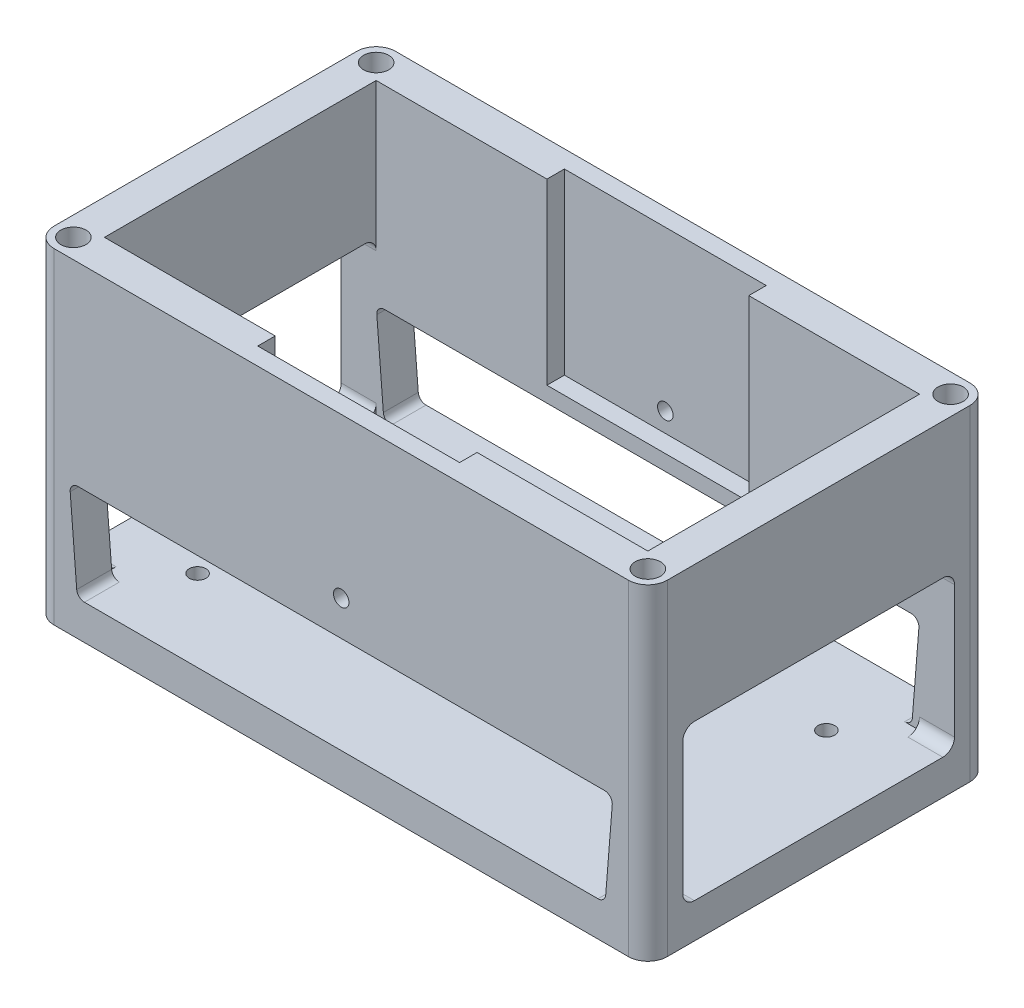
from build123d import *

# Parameters (mm, degrees)
BASE_W               = 79
BASE_H               = 44
BASE_R               = 1.075
BOSS_EXTRUDE1_DEPTH  = 42
SHELL1_T             = -4.5
CUT_EXTRUDE2_START   = 4.5
BASE_7_R             = 1.075
CUT_EXTRUDE2_DEPTH   = 67.211020086
CUT_EXTRUDE3_START   = 2
BASE_8_R             = 1.075
CUT_EXTRUDE3_DEPTH   = 2
SKETCH3_W            = 26
SKETCH3_H            = 39.5
CUT_EXTRUDE4_DEPTH   = 23
FILLET1_R            = 2.5
CUT_EXTRUDE5_DEPTH   = 39.5
CUT_EXTRUDE6_DEPTH   = 74.5
FILLET2_R            = 1
MOUNT_R              = 1.625
CUT_EXTRUDE7_DEPTH   = 2.4
CUT_EXTRUDE8_START   = -2.25
CAMERA_MOUNT_HOLE_R  = 1
CUT_EXTRUDE8_DEPTH   = 75.777581073
FILLET2_OF_MIRROR3_R = 1


with BuildPart() as part:
    # Base → Boss-Extrude1 (new body)
    # profile 1 of 9: a face of its own
    with BuildSketch(Plane(origin=(0, 0, 0), x_dir=(1, 0, 0), z_dir=(0, 1, 0))):
        Rectangle(BASE_W, BASE_H)
        Polygon((27, -10.345299462), (27, -12.654700538), (29, -13.809401077), (31, -12.654700538), (31, -10.345299462), (29, -9.190598923), align=None, mode=Mode.SUBTRACT)
        Polygon((-31, -10.345299462), (-31, -12.654700538), (-29, -13.809401077), (-27, -12.654700538), (-27, -10.345299462), (-29, -9.190598923), align=None, mode=Mode.SUBTRACT)
        Polygon((-31, 12.654700538), (-31, 10.345299462), (-29, 9.190598923), (-27, 10.345299462), (-27, 12.654700538), (-29, 13.809401077), align=None, mode=Mode.SUBTRACT)
        Polygon((27, 12.654700538), (27, 10.345299462), (29, 9.190598923), (31, 10.345299462), (31, 12.654700538), (29, 13.809401077), align=None, mode=Mode.SUBTRACT)
    # profile 2 of 9: a face of its own
    with BuildSketch(Plane(origin=(0, 0, 0), x_dir=(1, 0, 0), z_dir=(0, 1, 0))):
        Polygon((-29, -9.190598923), (-31, -10.345299462), (-31, -12.654700538), (-29, -13.809401077), (-27, -12.654700538), (-27, -10.345299462), align=None)
        with Locations((-29, -11.5)):
            Circle(BASE_R, mode=Mode.SUBTRACT)
    # profile 3 of 9: a face of its own
    with BuildSketch(Plane(origin=(0, 0, 0), x_dir=(1, 0, 0), z_dir=(0, 1, 0))):
        with Locations((-29, -11.5)):
            Circle(BASE_R)
    # profile 4 of 9: a face of its own
    with BuildSketch(Plane(origin=(0, 0, 0), x_dir=(1, 0, 0), z_dir=(0, 1, 0))):
        Polygon((-29, 13.809401077), (-31, 12.654700538), (-31, 10.345299462), (-29, 9.190598923), (-27, 10.345299462), (-27, 12.654700538), align=None)
        with Locations((-29, 11.5)):
            Circle(BASE_R, mode=Mode.SUBTRACT)
    # profile 5 of 9: a face of its own
    with BuildSketch(Plane(origin=(0, 0, 0), x_dir=(1, 0, 0), z_dir=(0, 1, 0))):
        with Locations((-29, 11.5)):
            Circle(BASE_R)
    # profile 6 of 9: a face of its own
    with BuildSketch(Plane(origin=(0, 0, 0), x_dir=(1, 0, 0), z_dir=(0, 1, 0))):
        Polygon((29, -9.190598923), (27, -10.345299462), (27, -12.654700538), (29, -13.809401077), (31, -12.654700538), (31, -10.345299462), align=None)
        with Locations((29, -11.5)):
            Circle(BASE_R, mode=Mode.SUBTRACT)
    # profile 7 of 9: a face of its own
    with BuildSketch(Plane(origin=(0, 0, 0), x_dir=(1, 0, 0), z_dir=(0, 1, 0))):
        with Locations((29, -11.5)):
            Circle(BASE_R)
    # profile 8 of 9: a face of its own
    with BuildSketch(Plane(origin=(0, 0, 0), x_dir=(1, 0, 0), z_dir=(0, 1, 0))):
        Polygon((29, 13.809401077), (27, 12.654700538), (27, 10.345299462), (29, 9.190598923), (31, 10.345299462), (31, 12.654700538), align=None)
        with Locations((29, 11.5)):
            Circle(BASE_R, mode=Mode.SUBTRACT)
    # profile 9 of 9: a face of its own
    with BuildSketch(Plane(origin=(0, 0, 0), x_dir=(1, 0, 0), z_dir=(0, 1, 0))):
        with Locations((29, 11.5)):
            Circle(BASE_R)
    extrude(amount=BOSS_EXTRUDE1_DEPTH)

    # Shell1
    shell1_openings = [part.faces().sort_by_distance(p)[0] for p in [
        (0, 42, 0),
    ]]
    offset(amount=SHELL1_T, openings=shell1_openings, kind=Kind.INTERSECTION)

    # Base<7> → Cut-Extrude2 (cut, through all)
    with BuildSketch(Plane(origin=(0, 0, 0), x_dir=(1, 0, 0), z_dir=(0, 1, 0)).offset(CUT_EXTRUDE2_START)):
        with Locations(Location((-29, -11.5, 0), (0, 0, 270))):
            Circle(BASE_7_R)
        with Locations(Location((-29, 11.5, 0), (0, 0, 270))):
            Circle(BASE_7_R)
        with Locations(Location((29, -11.5, 0), (0, 0, 270))):
            Circle(BASE_7_R)
        with Locations(Location((29, 11.5, 0), (0, 0, 270))):
            Circle(BASE_7_R)
    extrude(amount=-CUT_EXTRUDE2_DEPTH, mode=Mode.SUBTRACT)

    # Base<8> → Cut-Extrude3 (cut)
    # profile 1 of 4: a face of its own
    with BuildSketch(Plane(origin=(0, 0, 0), x_dir=(1, 0, 0), z_dir=(0, 1, 0)).offset(CUT_EXTRUDE3_START)):
        Polygon((29, 13.809401077), (27, 12.654700538), (27, 10.345299462), (29, 9.190598923), (31, 10.345299462), (31, 12.654700538), align=None)
        with Locations(Location((29, 11.5, 0), (0, 0, 270))):
            Circle(BASE_8_R, mode=Mode.SUBTRACT)
    # profile 2 of 4: a face of its own
    with BuildSketch(Plane(origin=(0, 0, 0), x_dir=(1, 0, 0), z_dir=(0, 1, 0)).offset(CUT_EXTRUDE3_START)):
        Polygon((29, -9.190598923), (27, -10.345299462), (27, -12.654700538), (29, -13.809401077), (31, -12.654700538), (31, -10.345299462), align=None)
        with Locations(Location((29, -11.5, 0), (0, 0, 270))):
            Circle(BASE_8_R, mode=Mode.SUBTRACT)
    # profile 3 of 4: a face of its own
    with BuildSketch(Plane(origin=(0, 0, 0), x_dir=(1, 0, 0), z_dir=(0, 1, 0)).offset(CUT_EXTRUDE3_START)):
        Polygon((-29, -9.190598923), (-31, -10.345299462), (-31, -12.654700538), (-29, -13.809401077), (-27, -12.654700538), (-27, -10.345299462), align=None)
        with Locations(Location((-29, -11.5, 0), (0, 0, 270))):
            Circle(BASE_8_R, mode=Mode.SUBTRACT)
    # profile 4 of 4: a face of its own
    with BuildSketch(Plane(origin=(0, 0, 0), x_dir=(1, 0, 0), z_dir=(0, 1, 0)).offset(CUT_EXTRUDE3_START)):
        Polygon((-29, 13.809401077), (-31, 12.654700538), (-31, 10.345299462), (-29, 9.190598923), (-27, 10.345299462), (-27, 12.654700538), align=None)
        with Locations(Location((-29, 11.5, 0), (0, 0, 270))):
            Circle(BASE_8_R, mode=Mode.SUBTRACT)
    extrude(amount=-CUT_EXTRUDE3_DEPTH, mode=Mode.SUBTRACT)

    # Sketch3 → Cut-Extrude4 (cut)
    with BuildSketch(Plane(origin=(0, 42, 0), x_dir=(1, 0, 0), z_dir=(0, 1, 0))):
        Rectangle(SKETCH3_W, SKETCH3_H)
    extrude(amount=-CUT_EXTRUDE4_DEPTH, mode=Mode.SUBTRACT)

    # Fillet1
    fillet1_edges = [part.edges().sort_by_distance(p)[0] for p in [
        (39.5, 21, 22),
        (-39.5, 21, 22),
        (-39.5, 21, -22),
        (39.5, 21, -22),
    ]]
    fillet(fillet1_edges, radius=FILLET1_R)

    # INPUTS → Cut-Extrude5 (cut)
    with BuildSketch(Plane.XY.offset(22)):
        Polygon((-35, 17), (-34, 4.5), (34, 4.5), (35, 17), align=None)
    cut_extrude5 = extrude(amount=-CUT_EXTRUDE5_DEPTH, mode=Mode.SUBTRACT)

    # SD_CARD → Cut-Extrude6 (cut)
    with BuildSketch(Plane.ZY.offset(39.5)):
        with BuildLine():
            Line((-16, 4.5), (16, 4.5))
            ThreePointArc((16, 4.5), (17.060660172, 4.939339828), (17.5, 6))
            Line((17.5, 6), (17.5, 23))
            ThreePointArc((17.5, 23), (17.060660172, 24.060660172), (16, 24.5))
            Line((16, 24.5), (-16, 24.5))
            ThreePointArc((-16, 24.5), (-17.060660172, 24.060660172), (-17.5, 23))
            Line((-17.5, 23), (-17.5, 6))
            ThreePointArc((-17.5, 6), (-17.060660172, 4.939339828), (-16, 4.5))
        make_face()
    cut_extrude6 = extrude(amount=-CUT_EXTRUDE6_DEPTH, mode=Mode.SUBTRACT)

    # Fillet2
    fillet2_edges = [part.edges().sort_by_distance(p)[0] for p in [
        (34, 4.5, 19.75),
        (35, 17, 19.75),
        (-35, 17, 19.75),
        (-34, 4.5, 19.75),
    ]]
    fillet(fillet2_edges, radius=FILLET2_R)

    # Mirror1: Cut-Extrude6 across plane
    add(cut_extrude6.mirror(Plane.ZY), mode=Mode.SUBTRACT)

    # Mount → Cut-Extrude7 (cut)
    with BuildSketch(Plane(origin=(0, 42, 0), x_dir=(1, 0, 0), z_dir=(0, 1, 0))):
        with Locations(Location((-37, 19.5, 0), (0, 0, 270))):
            Circle(MOUNT_R)
        with Locations(Location((37, 19.5, 0), (0, 0, 270))):
            Circle(MOUNT_R)
        with Locations(Location((37, -19.5, 0), (0, 0, 270))):
            Circle(MOUNT_R)
        with Locations(Location((-37, -19.5, 0), (0, 0, 270))):
            Circle(MOUNT_R)
    extrude(amount=-CUT_EXTRUDE7_DEPTH, mode=Mode.SUBTRACT)

    # Camera_Mount_Hole → Cut-Extrude8 (cut)
    with BuildSketch(Plane.XY.offset(22).offset(CUT_EXTRUDE8_START)):
        with Locations((0, 21.5)):
            Circle(CAMERA_MOUNT_HOLE_R)
    cut_extrude8 = extrude(amount=CUT_EXTRUDE8_DEPTH, mode=Mode.SUBTRACT)

    # Mirror2: Cut-Extrude8 across plane
    add(cut_extrude8.mirror(Plane.XY), mode=Mode.SUBTRACT)

    # Mirror3: Cut-Extrude5 across plane
    add(cut_extrude5.mirror(Plane.XY), mode=Mode.SUBTRACT)

    # Fillet2 of Mirror3
    fillet2_of_mirror3_edges = [part.edges().sort_by_distance(p)[0] for p in [
        (34, 4.5, -19.75),
        (35, 17, -19.75),
        (-35, 17, -19.75),
        (-34, 4.5, -19.75),
    ]]
    fillet(fillet2_of_mirror3_edges, radius=FILLET2_OF_MIRROR3_R)


solid = part.part
